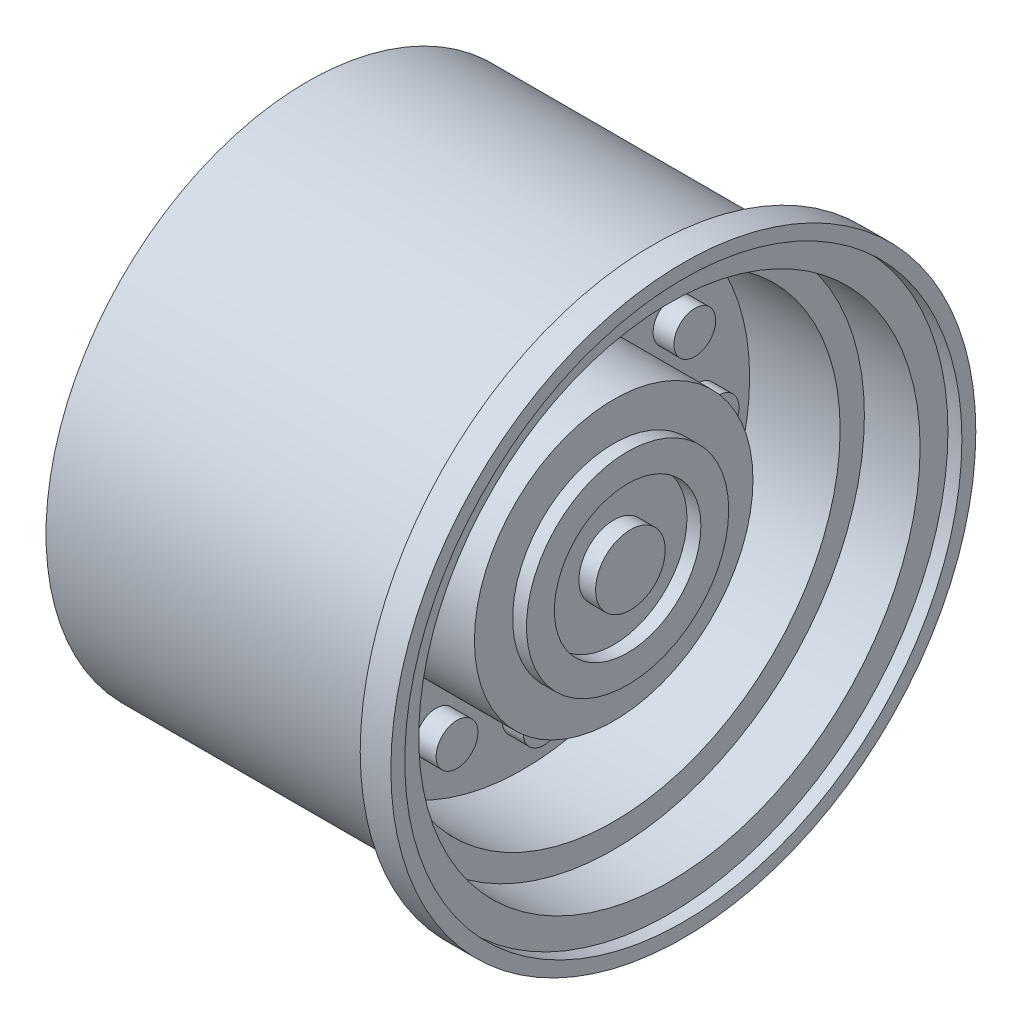
from build123d import *

# Parameters (mm, degrees)
SKETCH2_R           = 0.75
BOSS_EXTRUDE1_DEPTH = 0.75
SKETCH3_R           = 2.63
CUT_EXTRUDE1_DEPTH  = 0.5
SKETCH4_R           = 1.25
BOSS_EXTRUDE2_DEPTH = 0.6
SKETCH5_R           = 1.25
CUT_EXTRUDE2_DEPTH  = 5


with BuildPart() as part:
    # Sketch1 → Revolve2 (revolve)
    with BuildSketch(Plane.XY, mode=Mode.PRIVATE) as revolve2_sk:
        Polygon((0, 0), (-4.56, 0), (-4.56, 3.25), (-3.81, 3.25), (-3.81, 4.5), (-2.91, 4.5), (-2.91, 8.13), (-5.31, 8.13), (-5.31, 8.5), (-6.81, 8.5), (-6.81, 9.38), (5.59, 9.38), (5.59, 10.5), (6.69, 10.5), (6.69, 10), (6.19, 10), (6.19, 9), (4.19, 9), (4.19, 8.13), (0.94, 8.13), (0.94, 5), (4.19, 5), (4.19, 3.63), (4.69, 3.63), (4.69, 0), align=None)
    revolve(revolve2_sk.sketch.rotate(Axis((4.69, 0, 0), (-1, 0, 0)), 90), axis=Axis((4.69, 0, 0), (-1, 0, 0)))

    # Sketch2 → Boss-Extrude1 (add)
    with BuildSketch(Plane(origin=(0.94, 0, 0), x_dir=(0, 0, -1), z_dir=(1, 0, 0))):
        with Locations((0, 6.25)):
            Circle(SKETCH2_R)
        with Locations((3.125, 5.412658774)):
            Circle(SKETCH2_R)
        with Locations((5.412658774, 3.125)):
            Circle(SKETCH2_R)
        with Locations((6.25, 0)):
            Circle(SKETCH2_R)
        with Locations((5.412658774, -3.125)):
            Circle(SKETCH2_R)
        with Locations((3.125, -5.412658774)):
            Circle(SKETCH2_R)
        with Locations((0, -6.25)):
            Circle(SKETCH2_R)
        with Locations((-3.125, -5.412658774)):
            Circle(SKETCH2_R)
        with Locations((-5.412658774, -3.125)):
            Circle(SKETCH2_R)
        with Locations((-6.25, 0)):
            Circle(SKETCH2_R)
        with Locations((-5.412658774, 3.125)):
            Circle(SKETCH2_R)
        with Locations((-3.125, 5.412658774)):
            Circle(SKETCH2_R)
    extrude(amount=BOSS_EXTRUDE1_DEPTH)

    # Sketch3 → Cut-Extrude1 (cut)
    with BuildSketch(Plane(origin=(4.69, 0, 0), x_dir=(0, 0, -1), z_dir=(1, 0, 0))):
        Circle(SKETCH3_R)
    extrude(amount=-CUT_EXTRUDE1_DEPTH, mode=Mode.SUBTRACT)

    # Sketch4 → Boss-Extrude2 (add)
    with BuildSketch(Plane(origin=(4.19, 0, 0), x_dir=(0, 0, -1), z_dir=(1, 0, 0))):
        Circle(SKETCH4_R)
    extrude(amount=BOSS_EXTRUDE2_DEPTH)

    # Sketch5 → Cut-Extrude2 (cut)
    with BuildSketch(Plane.ZY.offset(4.56)):
        with Locations(Location((0, 0, 0), (0, 0, 180))):
            Circle(SKETCH5_R)
    extrude(amount=-CUT_EXTRUDE2_DEPTH, mode=Mode.SUBTRACT)


solid = part.part
